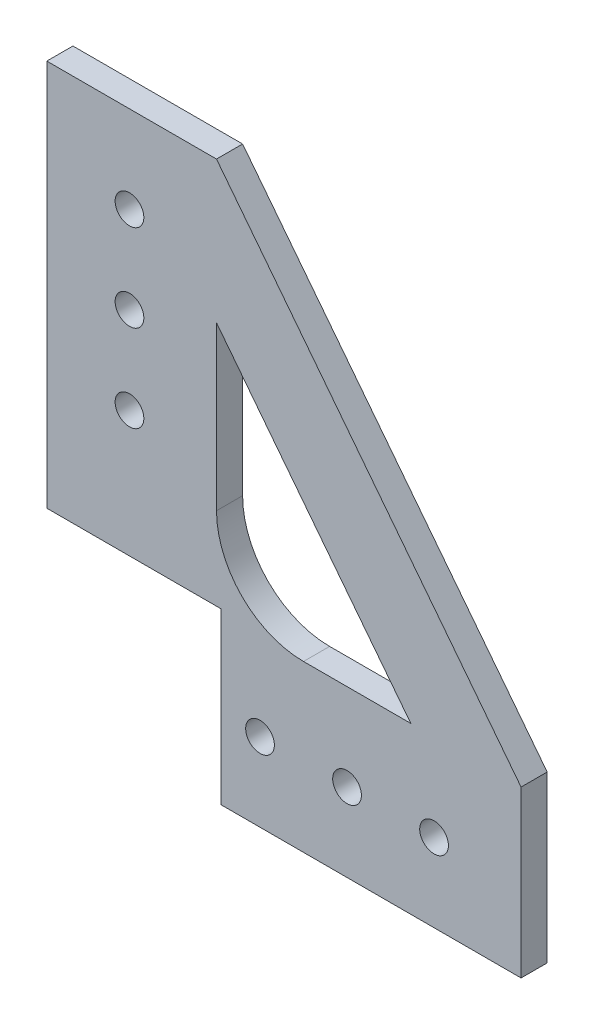
from build123d import *

# Parameters (mm, degrees)
SKETCH_1_R          = 1.65
EXTRUDE_1_DEPTH     = 3
CUT_EXTRUDE_1_DEPTH = 10


with BuildPart() as part:
    # 草图1 → 凸台-拉伸1 (new body)
    with BuildSketch(Plane.XY):
        Polygon((0, 0), (20, 0), (20, -20), (55, -20), (55, 0), (20, 45), (0, 45), align=None)
        with Locations((10, 15)):
            Circle(SKETCH_1_R, mode=Mode.SUBTRACT)
        with Locations((10, 35)):
            Circle(SKETCH_1_R, mode=Mode.SUBTRACT)
        with Locations((10, 25)):
            Circle(SKETCH_1_R, mode=Mode.SUBTRACT)
        with Locations((25, -10)):
            Circle(SKETCH_1_R, mode=Mode.SUBTRACT)
        with Locations((35, -10)):
            Circle(SKETCH_1_R, mode=Mode.SUBTRACT)
        with Locations((45, -10)):
            Circle(SKETCH_1_R, mode=Mode.SUBTRACT)
        with BuildLine():
            Line((20, 10), (20, 28.711779641))
            Line((20, 28.711779641), (42.331384166, 0))
            Line((42.331384166, 0), (30, 0))
            ThreePointArc((30, 0), (22.928932188, 2.928932188), (20, 10))
        make_face(mode=Mode.SUBTRACT)
    extrude(amount=EXTRUDE_1_DEPTH)

    # 草图2 → 切除-拉伸1 (cut)
    with BuildSketch(Plane.XY.offset(3)):
        Polygon((20.5, -19), (61.4403438, -19), (61.4403438, -24.760517067), (16.601724468, -23.670689514), (0, 0), (-5.850932492, 46.668097056), (0.5, 47.42662584), (0.5, 0.5), (20.5, 0.5), align=None)
    extrude(amount=-CUT_EXTRUDE_1_DEPTH, mode=Mode.SUBTRACT)


solid = part.part
